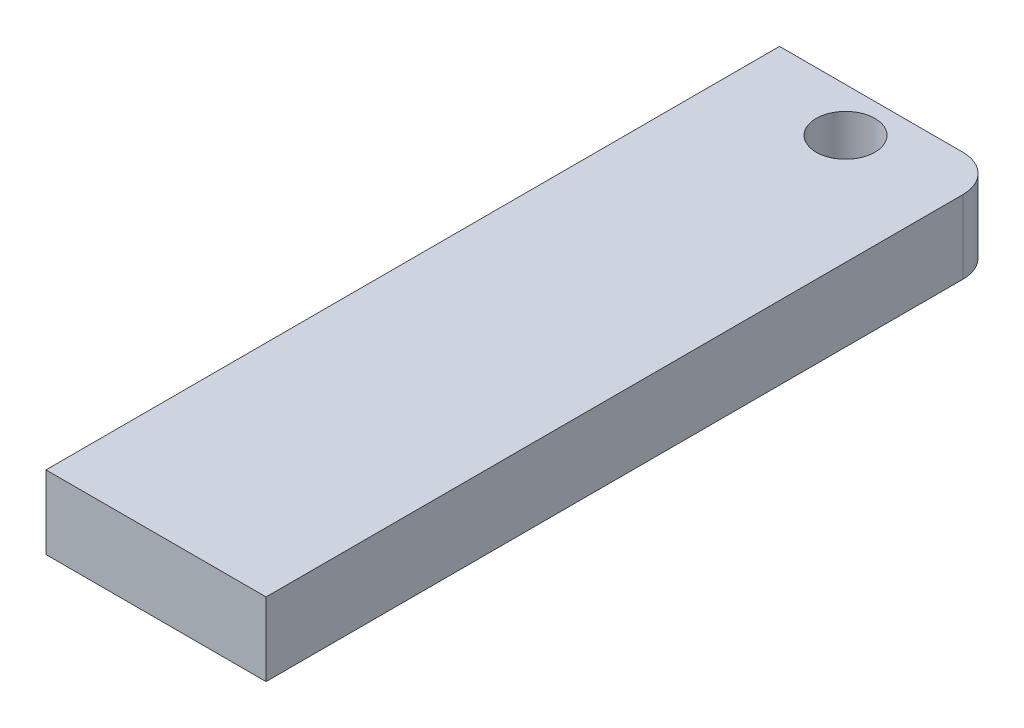
from build123d import *

# Parameters (mm, degrees)
SKETCH2_W           = 30
SKETCH2_H           = 10
BOSS_EXTRUDE1_DEPTH = 100
SKETCH3_R           = 4
CUT_EXTRUDE1_DEPTH  = 30
FILLET1_R           = 5


with BuildPart() as part:
    # Sketch2 → Boss-Extrude1 (new body)
    with BuildSketch(Plane.XY):
        with Locations((15, 5)):
            Rectangle(SKETCH2_W, SKETCH2_H)
    extrude(amount=BOSS_EXTRUDE1_DEPTH)

    # Sketch3 → Cut-Extrude1 (cut)
    with BuildSketch(Plane(origin=(0, 10, 0), x_dir=(1, 0, 0), z_dir=(0, 1, 0))):
        with Locations(Location((15, -6, 0), (0, 0, 270))):
            Circle(SKETCH3_R)
    extrude(amount=-CUT_EXTRUDE1_DEPTH, mode=Mode.SUBTRACT)

    # Fillet1
    fillet1_edges = [part.edges().sort_by_distance(p)[0] for p in [
        (30, 5, 0),
    ]]
    fillet(fillet1_edges, radius=FILLET1_R)


solid = part.part
